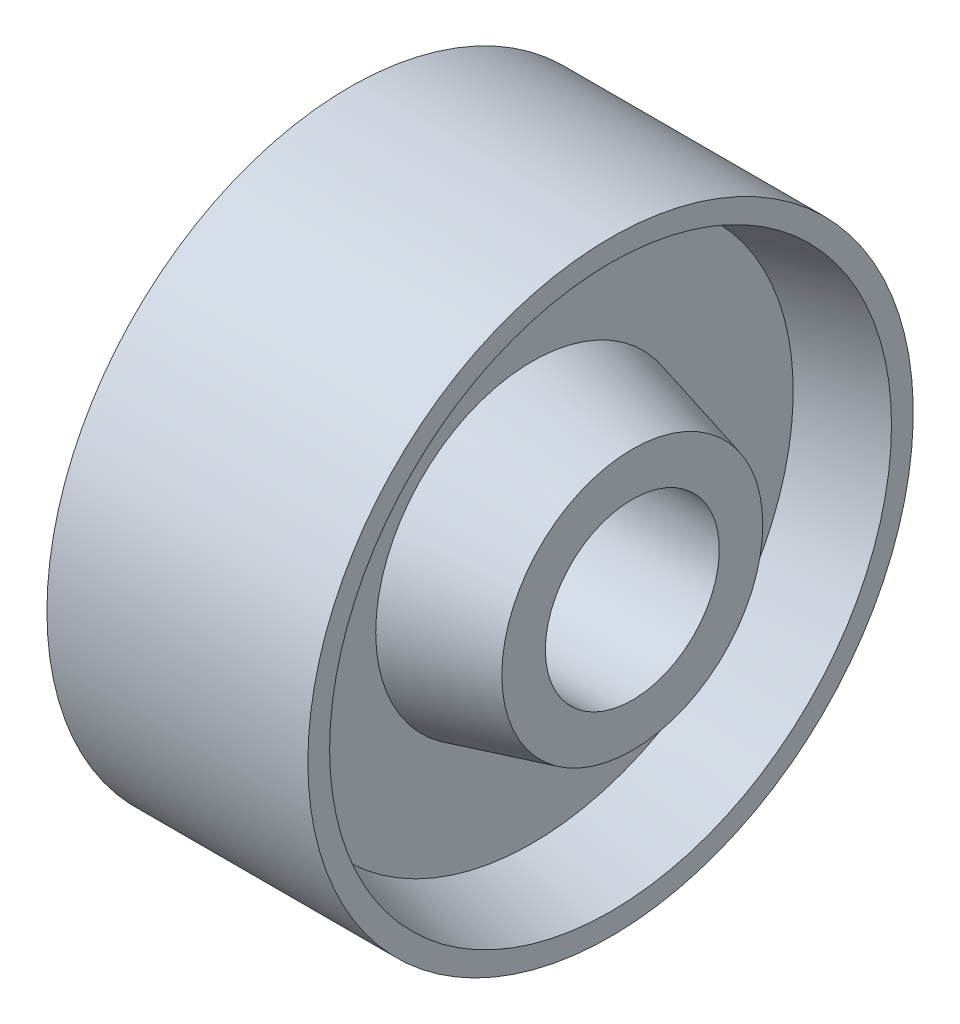
from build123d import *


with BuildPart() as part:
    # Sketch1 → Revolve1 (revolve)
    with BuildSketch(Plane.XY, mode=Mode.PRIVATE) as revolve1_sk:
        Polygon((-22.225, 12.7), (22.225, 12.7), (22.225, 19.05), (7.62, 22.86), (7.62, 38.1), (19.05, 41.021), (19.05, 44.196), (-19.05, 44.196), (-19.05, 41.021), (-7.62, 38.1), (-7.62, 22.86), (-22.225, 19.05), align=None)
    revolve(revolve1_sk.sketch.rotate(Axis((-95.541284404, 0, 0), (1, 0, 0)), 90), axis=Axis((-95.541284404, 0, 0), (1, 0, 0)))


solid = part.part
